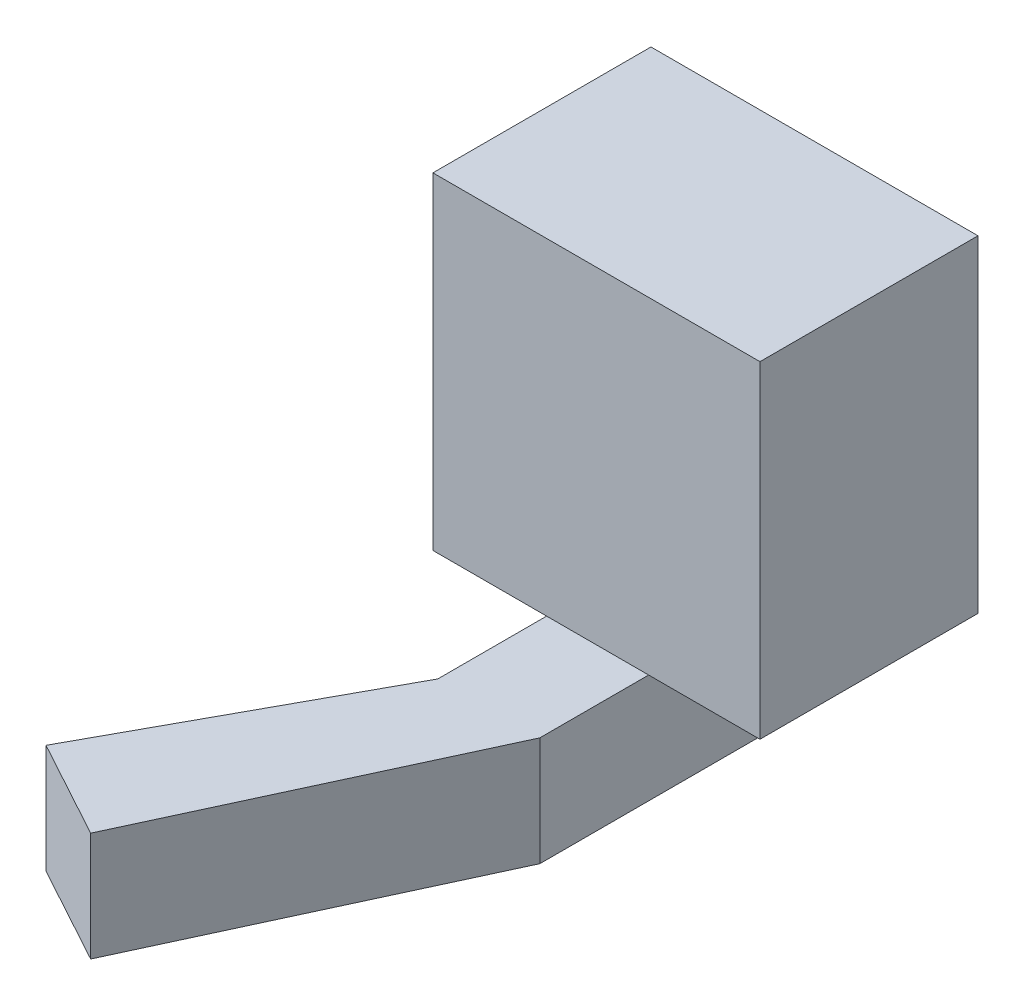
from build123d import *

# Parameters (mm, degrees)
SKETCH1_W           = 30
SKETCH1_H           = 30
BOSS_EXTRUDE1_DEPTH = 20
SKETCH2_W           = 9.360375711
SKETCH2_H           = 14.309479907
BOSS_EXTRUDE2_DEPTH = 10
BOSS_EXTRUDE3_DEPTH = 10


with BuildPart() as part:
    # Sketch1 → Boss-Extrude1 (new body)
    with BuildSketch(Plane.XY):
        with Locations((15, 15)):
            Rectangle(SKETCH1_W, SKETCH1_H)
    extrude(amount=BOSS_EXTRUDE1_DEPTH)

    # Sketch2 → Boss-Extrude2 (add)
    with BuildSketch(Plane.XZ):
        with Locations((15.108123152, 12.845260046)):
            Rectangle(SKETCH2_W, SKETCH2_H)
    extrude(amount=BOSS_EXTRUDE2_DEPTH)

    # Sketch3 → Boss-Extrude3 (add)
    with BuildSketch(Plane.XZ.offset(10)):
        Polygon((10.427935296, 29.980050477), (-2.268076866, 53.225538566), (6.759662186, 58.156228099), (19.788311007, 29.980050477), (19.788311007, 20), (10.427935296, 20), align=None)
    extrude(amount=-BOSS_EXTRUDE3_DEPTH)


solid = part.part
